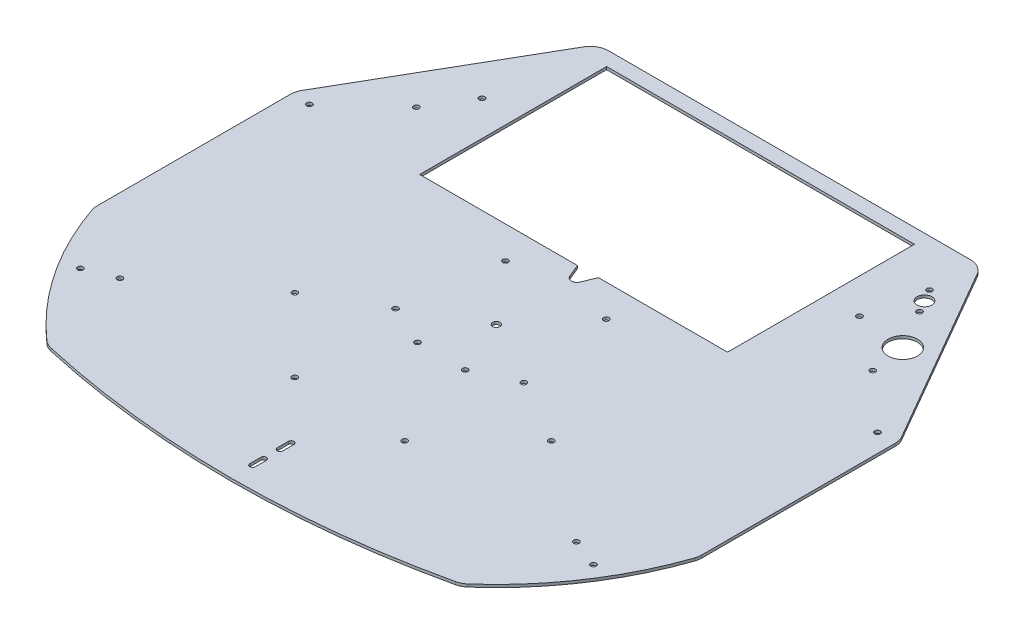
from build123d import *

# Parameters (mm, degrees)
BOSS_EXTRU_1_DEPTH      = 1.5
CONG_1_R                = 10
ESQUISSE4_R             = 8
ESQUISSE4_R_2           = 4
ESQUISSE4_R_3           = 1.5
ESQUISSE4_R_4           = 2
ENL_V_MAT_EXTRU_3_DEPTH = 3
ESQUISSE5_R             = 1.5
ENL_V_MAT_EXTRU_4_DEPTH = 230.841793557
ESQUISSE6_R             = 1.5
ENL_V_MAT_EXTRU_5_DEPTH = 230.841793557


with BuildPart() as part:
    # Esquisse1 → Boss.-Extru.1 (new body)
    with BuildSketch(Plane(origin=(0, 0, 0), x_dir=(1, 0, 0), z_dir=(0, 1, 0))):
        with BuildLine():
            Line((165, -54.556978373), (165, 55.241669751))
            Line((165, 55.241669751), (104.517749831, 160))
            Line((104.517749831, 160), (-104.517749831, 160))
            Line((-104.517749831, 160), (-165, 55.241669751))
            Line((-165, 55.241669751), (-165, -54.556978373))
            ThreePointArc((-165, -54.556978373), (-144.278322914, -96.877393783), (-112.949332972, -132.075402973))
            ThreePointArc((-112.949332972, -132.075402973), (0, -145), (112.949332972, -132.075402973))
            ThreePointArc((112.949332972, -132.075402973), (144.278322914, -96.877393783), (165, -54.556978373))
        make_face()
    extrude(amount=BOSS_EXTRU_1_DEPTH)

    # Congé1
    cong_1_edges = [part.edges().sort_by_distance(p)[0] for p in [
        (-112.949332972, 0.75, 132.075402973),
        (-165, 0.75, 54.556978373),
        (-165, 0.75, -55.241669751),
        (-104.517749831, 0.75, -160),
        (104.517749831, 0.75, -160),
        (165, 0.75, -55.241669751),
        (165, 0.75, 54.556978373),
        (112.949332972, 0.75, 132.075402973),
    ]]
    fillet(cong_1_edges, radius=CONG_1_R)

    # Esquisse4 → Enlèv. mat.-Extru.3 (cut)
    with BuildSketch(Plane(origin=(0, 1.5, 0), x_dir=(1, 0, 0), z_dir=(0, 1, 0))):
        with Locations(Location((121.838257906, 100, 0), (0, 0, 270))):
            Circle(ESQUISSE4_R)
        with Locations(Location((105.672450369, 128, 0), (0, 0, 270))):
            Circle(ESQUISSE4_R_2)
        with Locations(Location((101.922450369, 134.495190528, 0), (0, 0, 270))):
            Circle(ESQUISSE4_R_3)
        with Locations(Location((109.422450369, 121.504809472, 0), (0, 0, 270))):
            Circle(ESQUISSE4_R_3)
        with Locations(Location((-110.816043909, 103, 0), (0, 0, 270))):
            Circle(ESQUISSE4_R_3)
        with Locations(Location((95.183956091, 103, 0), (0, 0, 270))):
            Circle(ESQUISSE4_R_3)
        with Locations(Location((-27.5, 32.5, 0), (0, 0, 270))):
            Circle(ESQUISSE4_R_3)
        with Locations(Location((35, -20, 0), (0, 0, 270))):
            Circle(ESQUISSE4_R_3)
        with Locations(Location((27.5, 32.5, 0), (0, 0, 270))):
            Circle(ESQUISSE4_R_3)
        with Locations(Location((-13, -30, 0), (0, 0, 270))):
            Circle(ESQUISSE4_R_3)
        with Locations(Location((0, 0, 0), (0, 0, 270))):
            Circle(ESQUISSE4_R_4)
        with Locations(Location((-35, -20, 0), (0, 0, 270))):
            Circle(ESQUISSE4_R_3)
        with Locations(Location((13, -30, 0), (0, 0, 270))):
            Circle(ESQUISSE4_R_3)
        with Locations(Location((155, 53, 0), (0, 0, 270))):
            Circle(ESQUISSE4_R_3)
        with Locations(Location((140, -87, 0), (0, 0, 270))):
            Circle(ESQUISSE4_R_3)
        with Locations(Location((-140, -87, 0), (0, 0, 270))):
            Circle(ESQUISSE4_R_3)
        with Locations(Location((-155, 53, 0), (0, 0, 270))):
            Circle(ESQUISSE4_R_3)
        with BuildLine():
            Line((-91.816043909, 152), (76.183956091, 152))
            Line((76.183956091, 152), (76.183956091, 50))
            Line((76.183956091, 50), (5.732457975, 50))
            Line((5.732457975, 50), (2.771638598, 42.851949703))
            ThreePointArc((2.771638598, 42.851949703), (0, 41), (-2.771638598, 42.851949703))
            Line((-2.771638598, 42.851949703), (-5.732457975, 50))
            Line((-5.732457975, 50), (-91.816043909, 50))
            Line((-91.816043909, 50), (-91.816043909, 152))
        make_face()
    extrude(amount=-ENL_V_MAT_EXTRU_3_DEPTH, mode=Mode.SUBTRACT)

    # Esquisse5 → Enlèv. mat.-Extru.4 (cut, through all)
    with BuildSketch(Plane(origin=(0, 1.5, 0), x_dir=(1, 0, 0), z_dir=(0, 1, 0))):
        with Locations(Location((-30, -80, 0), (0, 0, 270))):
            Circle(ESQUISSE5_R)
        with Locations(Location((30, -80, 0), (0, 0, 90))):
            Circle(ESQUISSE5_R)
        with BuildLine():
            Line((1.5, -112), (1.5, -118))
            ThreePointArc((1.5, -118), (0, -119.5), (-1.5, -118))
            Line((-1.5, -118), (-1.5, -112))
            ThreePointArc((-1.5, -112), (0, -110.5), (1.5, -112))
        make_face()
        with BuildLine():
            Line((1.5, -127), (1.5, -133))
            ThreePointArc((1.5, -133), (0, -134.5), (-1.5, -133))
            Line((-1.5, -133), (-1.5, -127))
            ThreePointArc((-1.5, -127), (0, -125.5), (1.5, -127))
        make_face()
    extrude(amount=-ENL_V_MAT_EXTRU_4_DEPTH, mode=Mode.SUBTRACT)

    # Esquisse6 → Enlèv. mat.-Extru.5 (cut, through all)
    with BuildSketch(Plane(origin=(0, 1.5, 0), x_dir=(1, 0, 0), z_dir=(0, 1, 0))):
        with Locations(Location((-124.54257934, -80.8788967, 0), (0, 0, 270))):
            Circle(ESQUISSE6_R)
        with Locations(Location((-124.54257934, 80.8788967, 0), (0, 0, 270))):
            Circle(ESQUISSE6_R)
        with Locations(Location((124.54257934, -80.8788967, 0), (0, 0, 90))):
            Circle(ESQUISSE6_R)
        with Locations(Location((124.54257934, 80.8788967, 0), (0, 0, 90))):
            Circle(ESQUISSE6_R)
        with Locations(Location((70, -40, 0), (0, 0, 270))):
            Circle(ESQUISSE6_R)
        with Locations(Location((-70, -40, 0), (0, 0, 90))):
            Circle(ESQUISSE6_R)
    extrude(amount=-ENL_V_MAT_EXTRU_5_DEPTH, mode=Mode.SUBTRACT)


solid = part.part
